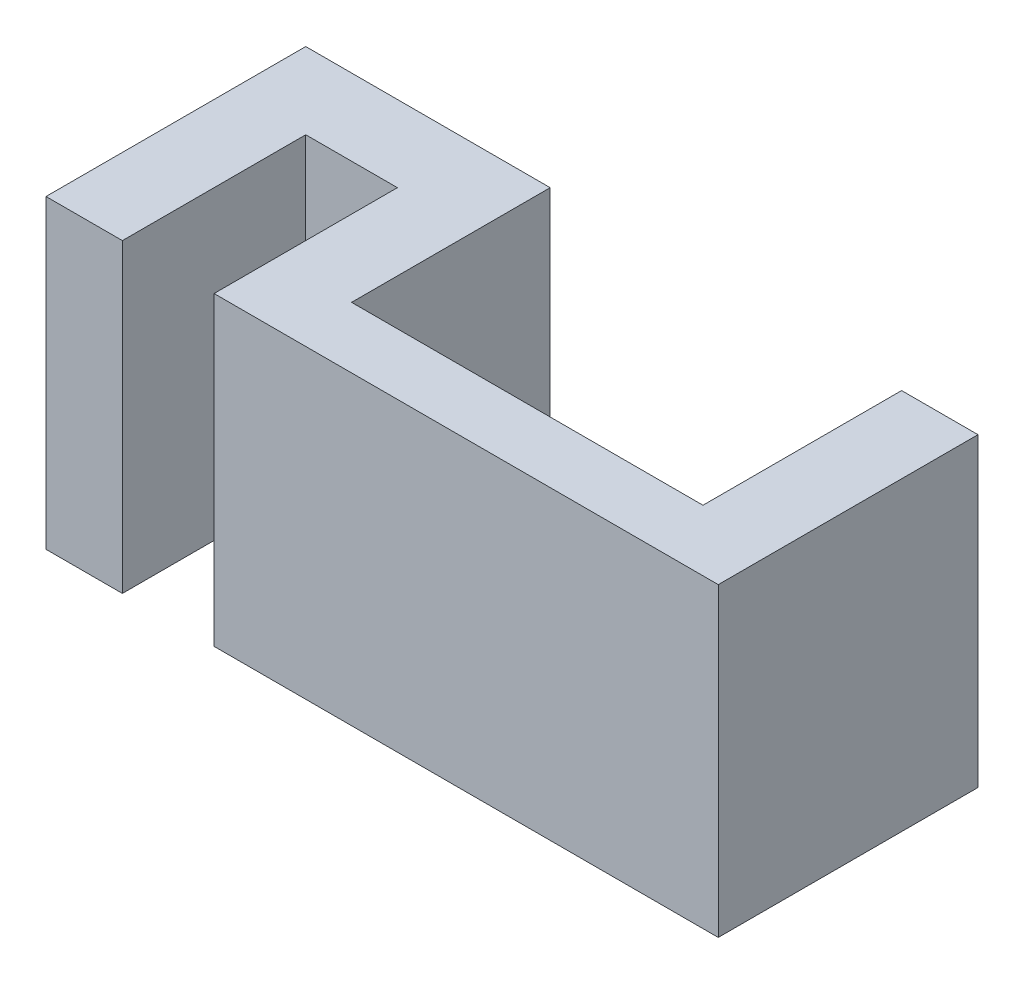
from build123d import *

# Parameters (mm, degrees)
BOSS_EXTRUDE1_DEPTH = 50.8


with BuildPart() as part:
    # Sketch1 → Boss-Extrude1 (new body)
    with BuildSketch(Plane(origin=(0, 0, 0), x_dir=(1, 0, 0), z_dir=(0, 1, 0))):
        Polygon((0, 0), (-12.7, 0), (-12.7, -33.02), (-71.12, -33.02), (-71.12, 0), (-111.76, 0), (-111.76, -43.18), (-99.06, -43.18), (-99.06, -12.7), (-83.82, -12.7), (-83.82, -43.18), (0, -43.18), align=None)
    extrude(amount=BOSS_EXTRUDE1_DEPTH)


solid = part.part
